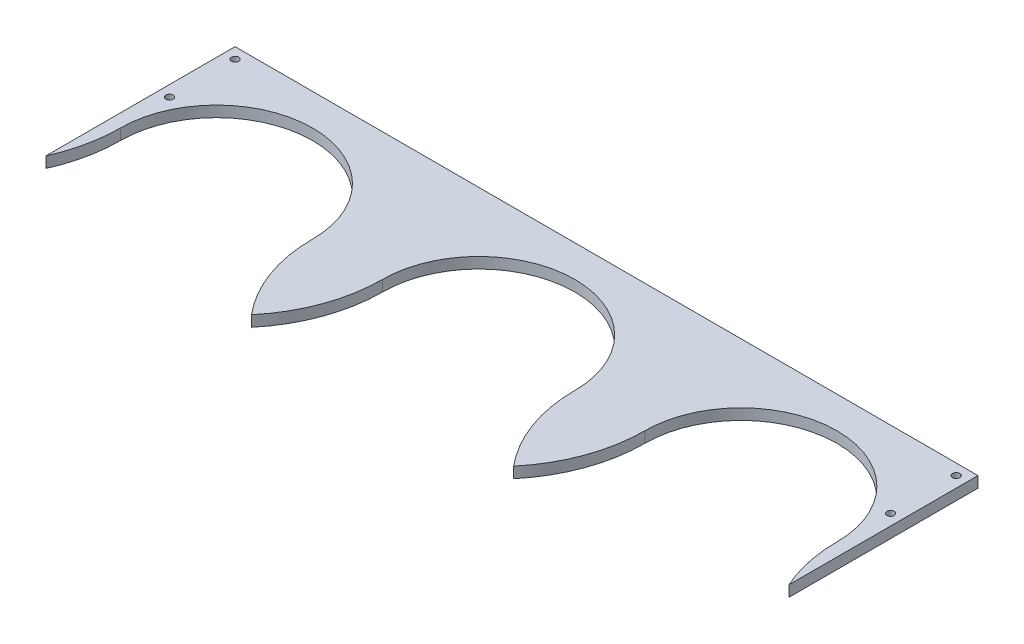
from build123d import *

# Parameters (mm, degrees)
SKETCH1_R           = 2.1209
BOSS_EXTRUDE1_DEPTH = 6.35


with BuildPart() as part:
    # Sketch1 → Boss-Extrude1 (new body)
    with BuildSketch(Plane(origin=(0, 0, 0), x_dir=(1, 0, 0), z_dir=(0, 1, 0))):
        with BuildLine():
            ThreePointArc((132.08, -74.295), (137.317671124, -104.024937773), (152.4, -130.175))
            ThreePointArc((152.4, -130.175), (167.482328876, -104.024937773), (172.72, -74.295))
            ThreePointArc((172.72, -74.295), (228.6, -18.415), (284.48, -74.295))
            ThreePointArc((284.48, -74.295), (289.717671124, -104.024937773), (304.8, -130.175))
            ThreePointArc((304.8, -130.175), (319.882328876, -104.024937773), (325.12, -74.295))
            ThreePointArc((325.12, -74.295), (381, -18.415), (436.88, -74.295))
            ThreePointArc((436.88, -74.295), (438.8063273, -92.500794407), (444.5, -109.900328253))
            Line((444.5, -109.900328253), (444.5, 0))
            Line((444.5, 0), (12.7, 0))
            Line((12.7, 0), (12.7, -109.900328253))
            ThreePointArc((12.7, -109.900328253), (18.3936727, -92.500794407), (20.32, -74.295))
            ThreePointArc((20.32, -74.295), (76.2, -18.415), (132.08, -74.295))
        make_face()
        with Locations((19.05, -44.45)):
            Circle(SKETCH1_R, mode=Mode.SUBTRACT)
        with Locations((19.05, -6.35)):
            Circle(SKETCH1_R, mode=Mode.SUBTRACT)
        with Locations((438.15, -6.35)):
            Circle(SKETCH1_R, mode=Mode.SUBTRACT)
        with Locations((438.15, -44.45)):
            Circle(SKETCH1_R, mode=Mode.SUBTRACT)
    extrude(amount=-BOSS_EXTRUDE1_DEPTH)


solid = part.part
